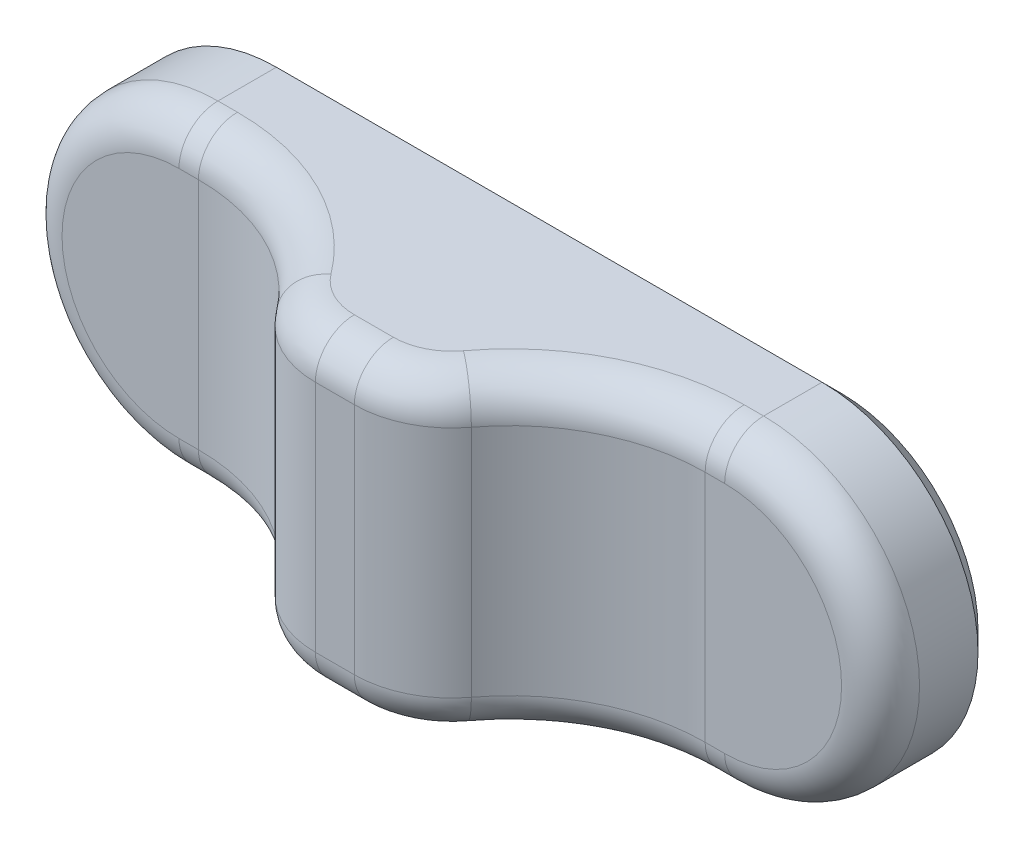
from build123d import *

# Parameters (mm, degrees)
BOSS_EXTRUDE1_DEPTH = 6
SKETCH2_W           = 8
SKETCH2_H           = 3
CUT_EXTRUDE1_DEPTH  = 17.027339923
SKETCH3_W           = 3.2
SKETCH3_H           = 3.2
CUT_EXTRUDE2_DEPTH  = 5
FILLET1_R           = 2.5
FILLET2_R           = 5
FILLET3_R           = 1
CHAMFER1_SIZE       = 0.5
CHAMFER2_SIZE       = 1


with BuildPart() as part:
    # Sketch1 → Boss-Extrude1 (new body)
    with BuildSketch(Plane.XY):
        with BuildLine():
            Line((5.475, -93.5), (-8.525, -93.5))
            ThreePointArc((-8.525, -93.5), (-12.525, -89.5), (-8.525, -85.5))
            Line((-8.525, -85.5), (5.475, -85.5))
            ThreePointArc((5.475, -85.5), (9.475, -89.5), (5.475, -93.5))
        make_face()
    extrude(amount=BOSS_EXTRUDE1_DEPTH)

    # Sketch2 → Cut-Extrude1 (cut, through all)
    with BuildSketch(Plane.XZ.offset(93.5)):
        with Locations((-8.525, 4.5)):
            Rectangle(SKETCH2_W, SKETCH2_H)
        with Locations((5.475, 4.5)):
            Rectangle(SKETCH2_W, SKETCH2_H)
    extrude(amount=-CUT_EXTRUDE1_DEPTH, mode=Mode.SUBTRACT)

    # Sketch3 → Cut-Extrude2 (cut)
    with BuildSketch(Plane(origin=(0, 0, 0), x_dir=(-1, 0, 0), z_dir=(0, 0, -1))):
        with Locations((1.525, -89.5)):
            Rectangle(SKETCH3_W, SKETCH3_H)
    extrude(amount=-CUT_EXTRUDE2_DEPTH, mode=Mode.SUBTRACT)

    # Fillet1
    fillet1_edges = [part.edges().sort_by_distance(p)[0] for p in [
        (-4.525, -89.5, 6),
        (1.475, -89.5, 6),
    ]]
    fillet(fillet1_edges, radius=FILLET1_R)

    # Fillet2
    fillet2_edges = [part.edges().sort_by_distance(p)[0] for p in [
        (1.475, -89.5, 3),
        (-4.525, -89.5, 3),
    ]]
    fillet(fillet2_edges, radius=FILLET2_R)

    # Fillet3
    fillet3_edges = [part.edges().sort_by_distance(p)[0] for p in [
        (-5.788932023, -93.5, 3.527864045),
        (-5.788932023, -85.5, 3.527864045),
        (-12.525, -89.5, 3),
        (-8.275, -85.5, 3),
        (-8.275, -93.5, 3),
        (9.475, -89.5, 3),
        (-1.525, -93.5, 6),
        (-3.143033989, -93.5, 5.736067977),
        (-1.525, -85.5, 6),
        (0.093033989, -85.5, 5.736067977),
        (5.225, -85.5, 3),
        (5.225, -93.5, 3),
        (0.093033989, -93.5, 5.736067977),
        (-3.143033989, -85.5, 5.736067977),
        (2.738932023, -93.5, 3.527864045),
        (2.738932023, -85.5, 3.527864045),
    ]]
    fillet(fillet3_edges, radius=FILLET3_R)

    # Chamfer1
    chamfer1_edges = [part.edges().sort_by_distance(p)[0] for p in [
        (-1.525, -93.5, 0),
        (-12.525, -89.5, 0),
        (-1.525, -85.5, 0),
        (9.475, -89.5, 0),
    ]]
    chamfer(chamfer1_edges, length=CHAMFER1_SIZE)

    # Chamfer2
    chamfer2_edges = [part.edges().sort_by_distance(p)[0] for p in [
        (0.075, -89.5, 5),
        (-1.525, -87.9, 5),
        (-3.125, -89.5, 5),
        (-1.525, -91.1, 5),
    ]]
    chamfer(chamfer2_edges, length=CHAMFER2_SIZE)


solid = part.part
